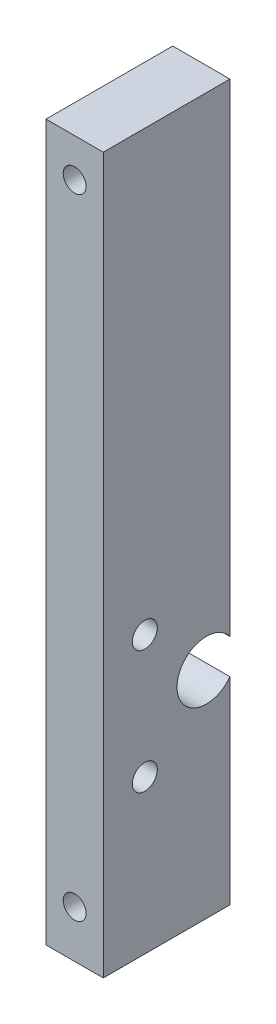
from build123d import *

# Parameters (mm, degrees)
SKETCH_1_W                      = 4
SKETCH_1_H                      = 49.98
LEFT_RF_PLATE_DEPTH             = 8.851909566
SKETCH_2_R                      = 0.8
FRAME_2XD1P6_THROUGH_DEPTH      = 47.728029093
SKETCH_3_R                      = 2.05
SMA_CENTER_D4P1_DEPTH           = 4
SKETCH_4_R                      = 0.875
SMA_UPPER_2XD1P75_THROUGH_DEPTH = 48.179152176


with BuildPart() as part:
    # 草图1 → Left_RF_Plate (new body)
    with BuildSketch(Plane.XY):
        with Locations((-2.3, 20.69)):
            Rectangle(SKETCH_1_W, SKETCH_1_H)
    extrude(amount=LEFT_RF_PLATE_DEPTH)


with BuildPart() as part_1:
    # Stock_Z_Position: moved
    add(part.part.moved(Location((0, 0, 2.248090434))))

    # 草图2 → Frame_2xD1p6_Through (cut, through all)
    with BuildSketch(Plane.XY.offset(11.1)):
        with Locations((-2.3, -1)):
            Circle(SKETCH_2_R)
        with Locations((-2.3, 43)):
            Circle(SKETCH_2_R)
    extrude(amount=-FRAME_2XD1P6_THROUGH_DEPTH, mode=Mode.SUBTRACT)

    # 草图3 → SMA_Center_D4p1 (cut)
    with BuildSketch(Plane.ZY.offset(4.3)):
        with Locations((3.899496327, 10.725)):
            Circle(SKETCH_3_R)
    extrude(amount=-SMA_CENTER_D4P1_DEPTH, mode=Mode.SUBTRACT)

    # 草图4 → SMA_Upper_2xD1p75_Through (cut, through all)
    with BuildSketch(Plane.ZY.offset(4.3)):
        with Locations((8.199496327, 6.425)):
            Circle(SKETCH_4_R)
        with Locations((8.199496327, 15.025)):
            Circle(SKETCH_4_R)
    extrude(amount=-SMA_UPPER_2XD1P75_THROUGH_DEPTH, mode=Mode.SUBTRACT)


solid = part_1.part
